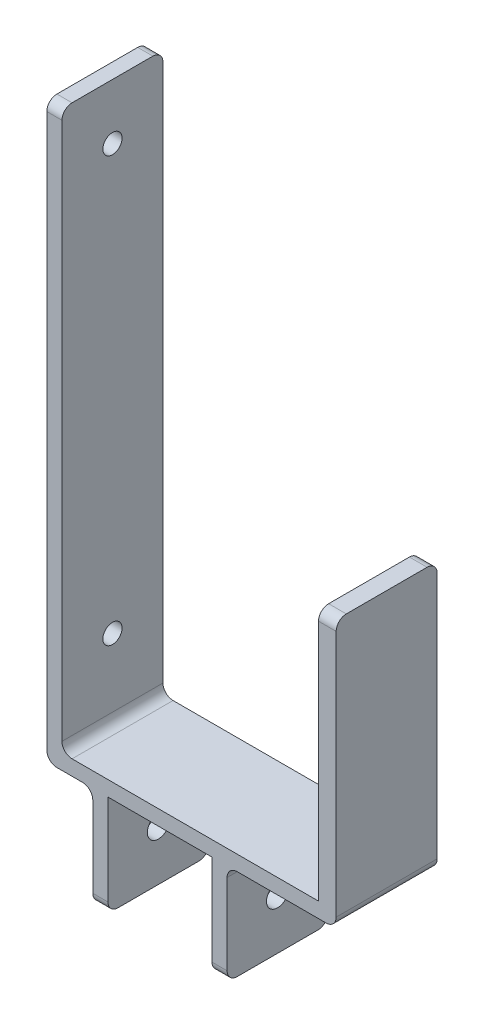
from build123d import *

# Parameters (mm, degrees)
BOSS_EXTRUDE1_DEPTH = 20
FILLET1_R           = 2
SKETCH2_R           = 1.9
SKETCH2_R_2         = 2.2
CUT_EXTRUDE1_DEPTH  = 40


with BuildPart() as part:
    # Sketch1 → Boss-Extrude1 (new body)
    with BuildSketch(Plane.XY):
        Polygon((-25.4, 0), (25.4, 0), (25.4, 50), (28.9, 50), (28.9, -3), (7.3, -3), (7.3, -23), (4.3, -23), (4.3, -3), (-16.3, -3), (-16.3, -23), (-19.3, -23), (-19.3, -3), (-28.4, -3), (-28.4, 110.5), (-25.4, 110.5), align=None)
    extrude(amount=BOSS_EXTRUDE1_DEPTH)

    # Fillet1
    fillet1_edges = [part.edges().sort_by_distance(p)[0] for p in [
        (27.15, 50, 0),
        (5.8, -23, 0),
        (-17.8, -23, 0),
        (-17.8, -23, 20),
        (-26.9, 110.5, 0),
        (-25.4, 0, 10),
        (28.9, -3, 10),
        (7.3, -3, 10),
        (-19.3, -3, 10),
        (-28.4, -3, 10),
        (5.8, -23, 20),
        (27.15, 50, 20),
        (-26.9, 110.5, 20),
    ]]
    fillet(fillet1_edges, radius=FILLET1_R)

    # Sketch2 → Cut-Extrude1 (cut)
    with BuildSketch(Plane.ZY.offset(28.4)):
        with Locations(Location((10, 99.5, 0), (0, 0, 270))):
            Circle(SKETCH2_R)
        with Locations(Location((10, 15.5, 0), (0, 0, 270))):
            Circle(SKETCH2_R)
        with Locations(Location((10, -13, 0), (0, 0, 270))):
            Circle(SKETCH2_R_2)
    extrude(amount=-CUT_EXTRUDE1_DEPTH, mode=Mode.SUBTRACT)


solid = part.part
